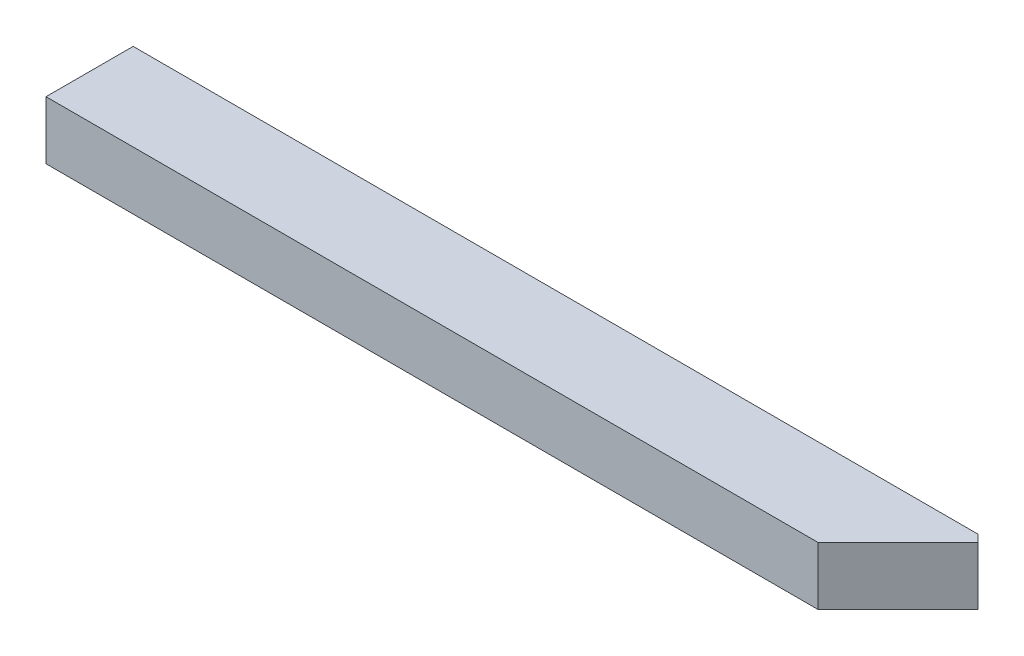
from build123d import *

# Parameters (mm, degrees)
SKETCH1_W               = 25.4
SKETCH1_H               = 25.4
BOSS_EXTRUDE1_DEPTH     = 350.298176974
BOSS_EXTRUDE2_DEPTH     = 25.4
CUT_EXTRUDE1_DEPTH      = 374.604024848
CUT_EXTRUDE1_DEPTH_BACK = 374.604024848
BOSS_EXTRUDE3_DEPTH     = 25.4


with BuildPart() as part:
    # Sketch1 → Boss-Extrude1 (new body)
    with BuildSketch(Plane(origin=(0, 0, 0), x_dir=(0, 0, -1), z_dir=(1, 0, 0))):
        Rectangle(SKETCH1_W, SKETCH1_H)
    extrude(amount=BOSS_EXTRUDE1_DEPTH)

    # Sketch2 → Boss-Extrude2 (add)
    with BuildSketch(Plane(origin=(0, 12.7, 0), x_dir=(1, 0, 0), z_dir=(0, 1, 0))):
        Polygon((350.298176974, -12.7), (372.523176974, 9.525), (372.523176974, 12.7), (350.298176974, 12.7), align=None)
    extrude(amount=-BOSS_EXTRUDE2_DEPTH)

    # Sketch3 → Cut-Extrude1 (cut, two sides: drawn at the far end of the back side and taken through both)
    with BuildSketch(Plane(origin=(0, 12.7, 0), x_dir=(1, 0, 0), z_dir=(0, 1, 0)).offset(-CUT_EXTRUDE1_DEPTH_BACK)):
        Polygon((372.523176974, 9.525), (369.348176974, 12.7), (372.523176974, 12.7), align=None)
    extrude(amount=CUT_EXTRUDE1_DEPTH + CUT_EXTRUDE1_DEPTH_BACK, mode=Mode.SUBTRACT)

    # Sketch4 → Boss-Extrude3 (add)
    with BuildSketch(Plane(origin=(0, 12.7, 0), x_dir=(1, 0, 0), z_dir=(0, 1, 0))):
        Polygon((0, -12.7), (0, -25.4), (337.598176974, -25.4), (350.298176974, -12.7), align=None)
    extrude(amount=-BOSS_EXTRUDE3_DEPTH)


solid = part.part
